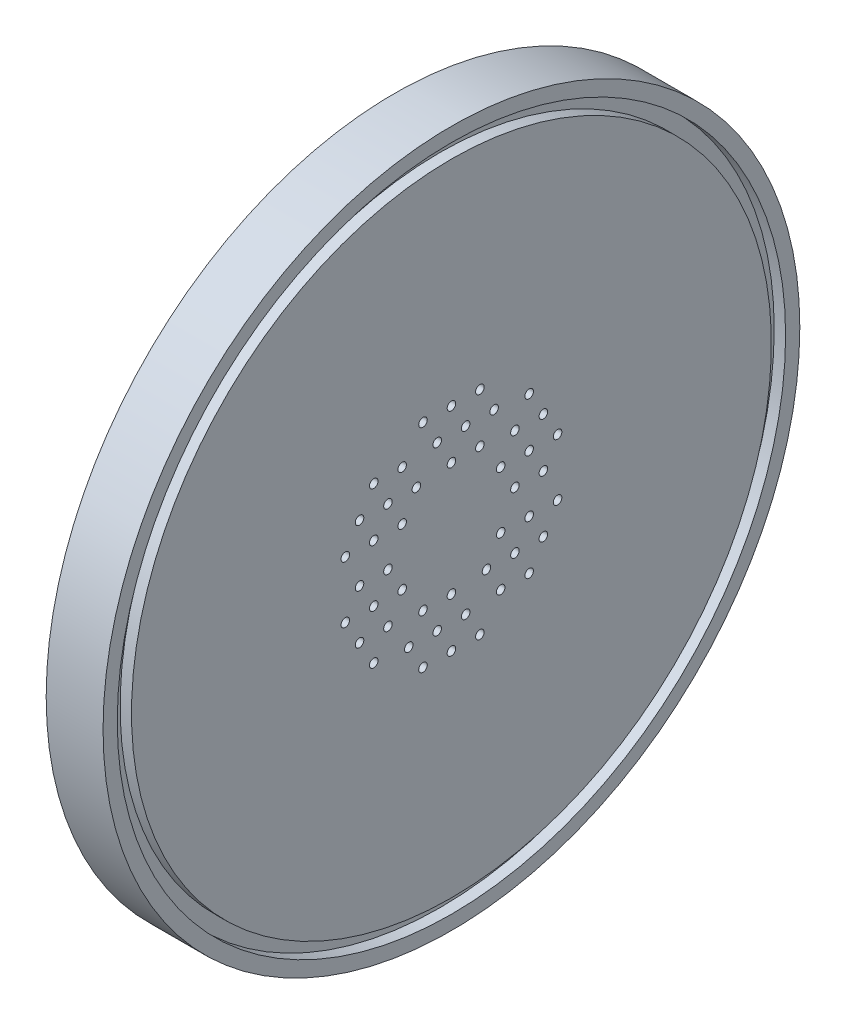
from build123d import *

# Parameters (mm, degrees)
SKETCH2_R                    = 0.762
CUT_EXTRUDE1_DEPTH           = 109.240960824
CHAMFER1_SIZE                = 0.508
CIRPATTERN1_COUNT            = 6
CHAMFER1_OF_CIRPATTERN1_SIZE = 0.508
SKETCH3_R                    = 3.175
CUT_EXTRUDE2_DEPTH           = 109.240960824
CIRPATTERN2_COUNT            = 8
SKETCH4_W                    = 2.032
SKETCH4_H                    = 2.54
CUT_EXTRUDE3_DEPTH           = 108.95
CUT_EXTRUDE3_DEPTH_BACK      = 108.95
SKETCH5_R                    = 76.2
SKETCH5_R_2                  = 62.23
SKETCH6_R                    = 31.75
SKETCH6_R_2                  = 25.4
BOSS_EXTRUDE1_DEPTH          = 6.35
CUT_EXTRUDE4_START           = -6.35
CUT_EXTRUDE4_DEPTH           = 6.35
CIRPATTERN3_COUNT            = 6


with BuildPart() as part:
    # Sketch1 → Revolve1 (revolve)
    with BuildSketch(Plane.XY, mode=Mode.PRIVATE) as revolve1_sk:
        with BuildLine():
            Line((0, 0), (0, 48.26))
            ThreePointArc((0, 48.26), (-0.743948776, 50.056051224), (-2.54, 50.8))
            Line((-2.54, 50.8), (-6.35, 50.8))
            Line((-6.35, 50.8), (-6.35, 76.2))
            Line((-6.35, 76.2), (3.81, 76.2))
            Line((3.81, 76.2), (3.81, 0))
            Line((3.81, 0), (0, 0))
        make_face()
    revolve(revolve1_sk.sketch.rotate(Axis((-6.35, 0, 0), (1, 0, 0)), 180), axis=Axis((-6.35, 0, 0), (1, 0, 0)))

    # Sketch2 → Cut-Extrude1 (cut, through all)
    with BuildSketch(Plane(origin=(3.81, 0, 0), x_dir=(0, 0, -1), z_dir=(1, 0, 0))):
        with Locations(Location((0, 10.16, 0), (0, 0, 90))):
            Circle(SKETCH2_R)
        with Locations(Location((-2.54, 14.559409051, 0), (0, 0, 90))):
            Circle(SKETCH2_R)
        with Locations(Location((5.08, 10.16, 0), (0, 0, 90))):
            Circle(SKETCH2_R)
        with Locations(Location((-5.08, 18.958818102, 0), (0, 0, 90))):
            Circle(SKETCH2_R)
        with Locations(Location((0, 18.958818102, 0), (0, 0, 90))):
            Circle(SKETCH2_R)
        with Locations(Location((5.08, 18.958818102, 0), (0, 0, 90))):
            Circle(SKETCH2_R)
        with Locations(Location((7.62, 14.559409051, 0), (0, 0, 90))):
            Circle(SKETCH2_R)
        with Locations(Location((2.54, 14.559409051, 0), (0, 0, 90))):
            Circle(SKETCH2_R)
    cut_extrude1 = extrude(amount=-CUT_EXTRUDE1_DEPTH, mode=Mode.SUBTRACT)

    # Chamfer1
    chamfer1_edges = [part.edges().sort_by_distance(p)[0] for p in [
        (0, 18.196818102, 5.08),
        (0, 13.797409051, 2.54),
        (0, 18.196818102, 0),
        (0, 18.196818102, -5.08),
        (0, 13.797409051, -7.62),
        (0, 13.797409051, -2.54),
        (0, 9.398, 0),
        (0, 9.398, -5.08),
    ]]
    chamfer(chamfer1_edges, length=CHAMFER1_SIZE)

    # CirPattern1: Cut-Extrude1 ×6 about axis
    cirpattern1_axis = Axis((0, 0, 0), (1, 0, 0))
    for i in range(1, CIRPATTERN1_COUNT):
        add(cut_extrude1.rotate(cirpattern1_axis, i * 360 / CIRPATTERN1_COUNT), mode=Mode.SUBTRACT)

    # Chamfer1 of CirPattern1
    chamfer1_of_cirpattern1_edges = [part.edges().sort_by_distance(p)[0] for p in [
        (0, 4.699, 18.298906745),
        (0, 4.699, 13.218906745),
        (0, 9.098409051, 15.758906745),
        (0, 13.497818102, 13.218906745),
        (0, 13.497818102, 8.138906745),
        (0, 9.098409051, 10.678906745),
        (0, 4.699, 8.138906745),
        (0, 9.098409051, 5.598906745),
        (0, -13.497818102, 13.218906745),
        (0, -9.098409051, 10.678906745),
        (0, -9.098409051, 15.758906745),
        (0, -4.699, 18.298906745),
        (0, -0.299590949, 15.758906745),
        (0, -4.699, 13.218906745),
        (0, -4.699, 8.138906745),
        (0, -0.299590949, 10.678906745),
        (0, -18.196818102, -5.08),
        (0, -13.797409051, -2.54),
        (0, -18.196818102, 0),
        (0, -18.196818102, 5.08),
        (0, -13.797409051, 7.62),
        (0, -13.797409051, 2.54),
        (0, -9.398, 0),
        (0, -9.398, 5.08),
        (0, -4.699, -18.298906745),
        (0, -4.699, -13.218906745),
        (0, -9.098409051, -15.758906745),
        (0, -13.497818102, -13.218906745),
        (0, -13.497818102, -8.138906745),
        (0, -9.098409051, -10.678906745),
        (0, -4.699, -8.138906745),
        (0, -9.098409051, -5.598906745),
        (0, 13.497818102, -13.218906745),
        (0, 9.098409051, -10.678906745),
        (0, 9.098409051, -15.758906745),
        (0, 4.699, -18.298906745),
        (0, 0.299590949, -15.758906745),
        (0, 4.699, -13.218906745),
        (0, 4.699, -8.138906745),
        (0, 0.299590949, -10.678906745),
    ]]
    chamfer(chamfer1_of_cirpattern1_edges, length=CHAMFER1_OF_CIRPATTERN1_SIZE)

    # Sketch3 → Cut-Extrude2 (cut, through all)
    with BuildSketch(Plane(origin=(3.81, 0, 0), x_dir=(0, 0, -1), z_dir=(1, 0, 0))):
        with Locations(Location((-66.802, 0, 0), (0, 0, 90))):
            Circle(SKETCH3_R)
    cut_extrude2 = extrude(amount=-CUT_EXTRUDE2_DEPTH, mode=Mode.SUBTRACT)

    # CirPattern2: Cut-Extrude2 ×8 about axis
    cirpattern2_axis = Axis((0, 0, 0), (1, 0, 0))
    for i in range(1, CIRPATTERN2_COUNT):
        add(cut_extrude2.rotate(cirpattern2_axis, i * 360 / CIRPATTERN2_COUNT), mode=Mode.SUBTRACT)

    # Sketch4 → Cut-Revolve1 (revolve, cut)
    with BuildSketch(Plane.XY):
        with Locations((2.794, 58.42)):
            Rectangle(SKETCH4_W, SKETCH4_H)
    revolve(axis=Axis((0, 0, 0), (-1, 0, 0)), mode=Mode.SUBTRACT)

    # Sketch5 → Cut-Extrude3 (cut, two sides: drawn at the far end of the back side and taken through both)
    with BuildSketch(Plane(origin=(0, 0, 0), x_dir=(0, 0, -1), z_dir=(1, 0, 0)).offset(-CUT_EXTRUDE3_DEPTH_BACK)):
        Circle(SKETCH5_R)
        Circle(SKETCH5_R_2, mode=Mode.SUBTRACT)
    extrude(amount=CUT_EXTRUDE3_DEPTH + CUT_EXTRUDE3_DEPTH_BACK, mode=Mode.SUBTRACT)

    # Sketch6 → Boss-Extrude1 (add)
    with BuildSketch(Plane.ZY):
        with Locations(Location((0, 0, 0), (0, 0, 90))):
            Circle(SKETCH6_R)
        with Locations(Location((0, 0, 0), (0, 0, 270))):
            Circle(SKETCH6_R_2, mode=Mode.SUBTRACT)
    extrude(amount=BOSS_EXTRUDE1_DEPTH)

    # Sketch7 → Cut-Extrude4 (cut)
    with BuildSketch(Plane.ZY.offset(6.35).offset(CUT_EXTRUDE4_START)):
        with BuildLine():
            Line((8.3058, -30.644349991), (8.3058, 30.644349991))
            ThreePointArc((8.3058, 30.644349991), (0, 31.75), (-8.3058, 30.644349991))
            Line((-8.3058, 30.644349991), (-8.3058, -30.644349991))
            ThreePointArc((-8.3058, -30.644349991), (0, -31.75), (8.3058, -30.644349991))
        make_face()
    cut_extrude4 = extrude(amount=CUT_EXTRUDE4_DEPTH, mode=Mode.SUBTRACT)

    # CirPattern3: Cut-Extrude4 ×6 about axis
    cirpattern3_axis = Axis((0, 0, 0), (1, 0, 0))
    for i in range(1, CIRPATTERN3_COUNT):
        add(cut_extrude4.rotate(cirpattern3_axis, i * 360 / CIRPATTERN3_COUNT), mode=Mode.SUBTRACT)


solid = part.part
